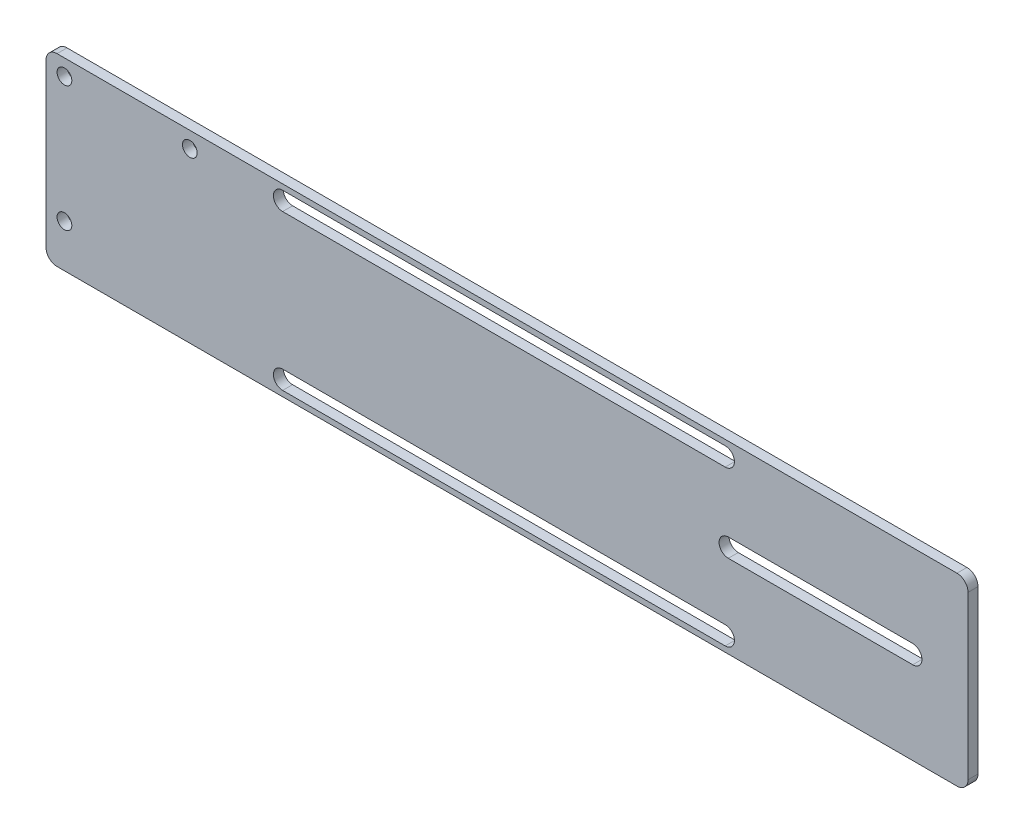
from build123d import *

# Parameters (mm, degrees)
SKETCH_1_R      = 2
EXTRUDE_1_DEPTH = 2.7


with BuildPart() as part:
    # 草图1 → 凸台-拉伸1 (new body)
    with BuildSketch(Plane.XY):
        with BuildLine():
            ThreePointArc((3, 25), (0.878679656, 24.121320344), (0, 22))
            Line((0, 22), (0, -22))
            ThreePointArc((0, -22), (0.878679656, -24.121320344), (3, -25))
            Line((3, -25), (247, -25))
            ThreePointArc((247, -25), (249.121320344, -24.121320344), (250, -22))
            Line((250, -22), (250, 22))
            ThreePointArc((250, 22), (249.121320344, 24.121320344), (247, 25))
            Line((247, 25), (3, 25))
        make_face()
        with Locations(Location((5, -13.35, 0), (0, 0, 180))):
            Circle(SKETCH_1_R, mode=Mode.SUBTRACT)
        with BuildLine():
            Line((184.15863574, -23.5), (64.15863574, -23.5))
            ThreePointArc((64.15863574, -23.5), (61.65863574, -21), (64.15863574, -18.5))
            Line((64.15863574, -18.5), (184.15863574, -18.5))
            ThreePointArc((184.15863574, -18.5), (185.926402692, -19.232233047), (186.65863574, -21))
            ThreePointArc((186.65863574, -21), (185.926402692, -22.767766953), (184.15863574, -23.5))
        make_face(mode=Mode.SUBTRACT)
        with BuildLine():
            ThreePointArc((185, -2.5), (182.5, 0), (185, 2.5))
            Line((185, 2.5), (235, 2.5))
            ThreePointArc((235, 2.5), (236.767766953, 1.767766953), (237.5, 0))
            ThreePointArc((237.5, 0), (236.767766953, -1.767766953), (235, -2.5))
            Line((235, -2.5), (185, -2.5))
        make_face(mode=Mode.SUBTRACT)
        with Locations(Location((5, 20.65, 0), (0, 0, 180))):
            Circle(SKETCH_1_R, mode=Mode.SUBTRACT)
        with Locations(Location((39, 20.65, 0), (0, 0, 180))):
            Circle(SKETCH_1_R, mode=Mode.SUBTRACT)
        with BuildLine():
            Line((184.15863574, 18.5), (64.15863574, 18.5))
            ThreePointArc((64.15863574, 18.5), (61.65863574, 21), (64.15863574, 23.5))
            Line((64.15863574, 23.5), (184.15863574, 23.5))
            ThreePointArc((184.15863574, 23.5), (185.926402692, 22.767766953), (186.65863574, 21))
            ThreePointArc((186.65863574, 21), (185.926402692, 19.232233047), (184.15863574, 18.5))
        make_face(mode=Mode.SUBTRACT)
    extrude(amount=EXTRUDE_1_DEPTH)


solid = part.part
